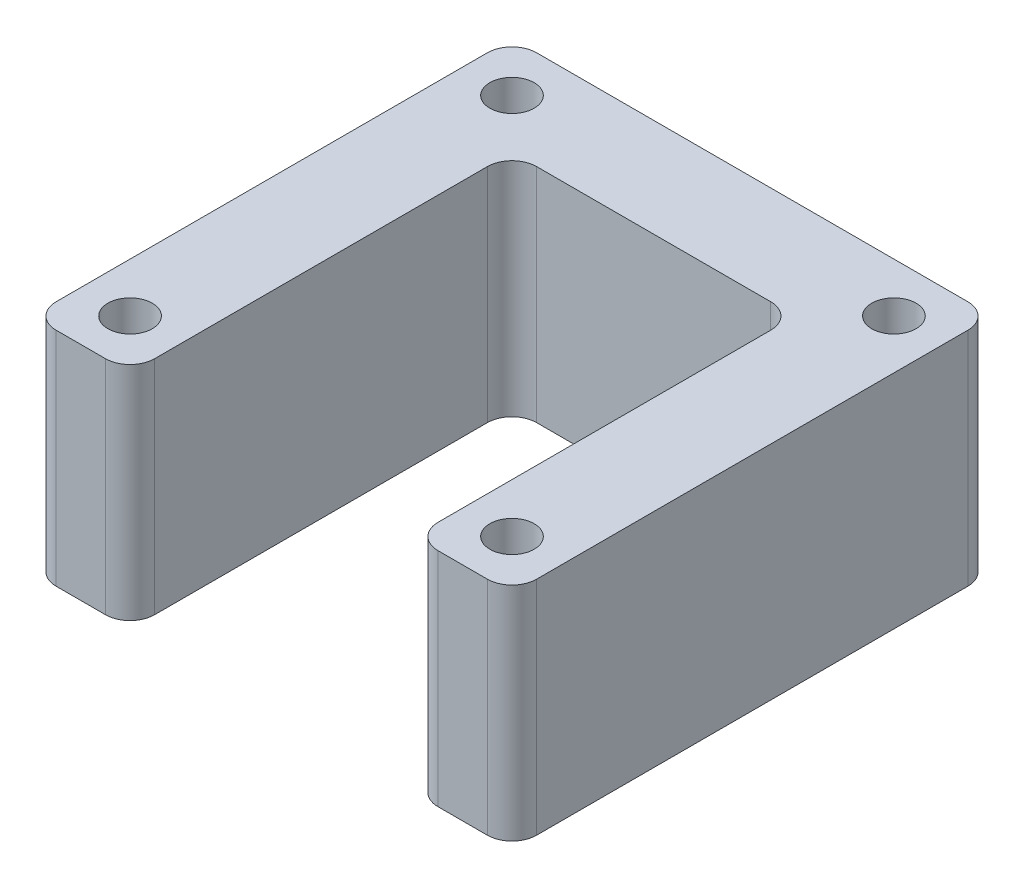
from build123d import *

# Parameters (mm, degrees)
SKETCH1_R           = 1.8
BOSS_EXTRUDE1_DEPTH = 18
FILLET1_R           = 2


with BuildPart() as part:
    # Sketch1 → Boss-Extrude1 (new body)
    with BuildSketch(Plane(origin=(0, 0, 0), x_dir=(1, 0, 0), z_dir=(0, 1, 0))):
        Polygon((-15.607361963, 23.262883436), (-15.607361963, -15.737116564), (-7.607361963, -15.737116564), (-7.607361963, 15.262883436), (15.392638037, 15.262883436), (15.392638037, -15.737116564), (23.392638037, -15.737116564), (23.392638037, 23.262883436), align=None)
        with Locations(Location((-11.607361963, -11.737116564, 0), (0, 0, 270))):
            Circle(SKETCH1_R, mode=Mode.SUBTRACT)
        with Locations(Location((19.392638037, -11.737116564, 0), (0, 0, 270))):
            Circle(SKETCH1_R, mode=Mode.SUBTRACT)
        with Locations(Location((19.392638037, 19.262883436, 0), (0, 0, 270))):
            Circle(SKETCH1_R, mode=Mode.SUBTRACT)
        with Locations(Location((-11.607361963, 19.262883436, 0), (0, 0, 270))):
            Circle(SKETCH1_R, mode=Mode.SUBTRACT)
    extrude(amount=BOSS_EXTRUDE1_DEPTH)

    # Fillet1
    fillet1_edges = [part.edges().sort_by_distance(p)[0] for p in [
        (-15.607361963, 9, -23.262883436),
        (23.392638037, 9, -23.262883436),
        (23.392638037, 9, 15.737116564),
        (15.392638037, 9, 15.737116564),
        (15.392638037, 9, -15.262883436),
        (-7.607361963, 9, -15.262883436),
        (-7.607361963, 9, 15.737116564),
        (-15.607361963, 9, 15.737116564),
    ]]
    fillet(fillet1_edges, radius=FILLET1_R)


solid = part.part
